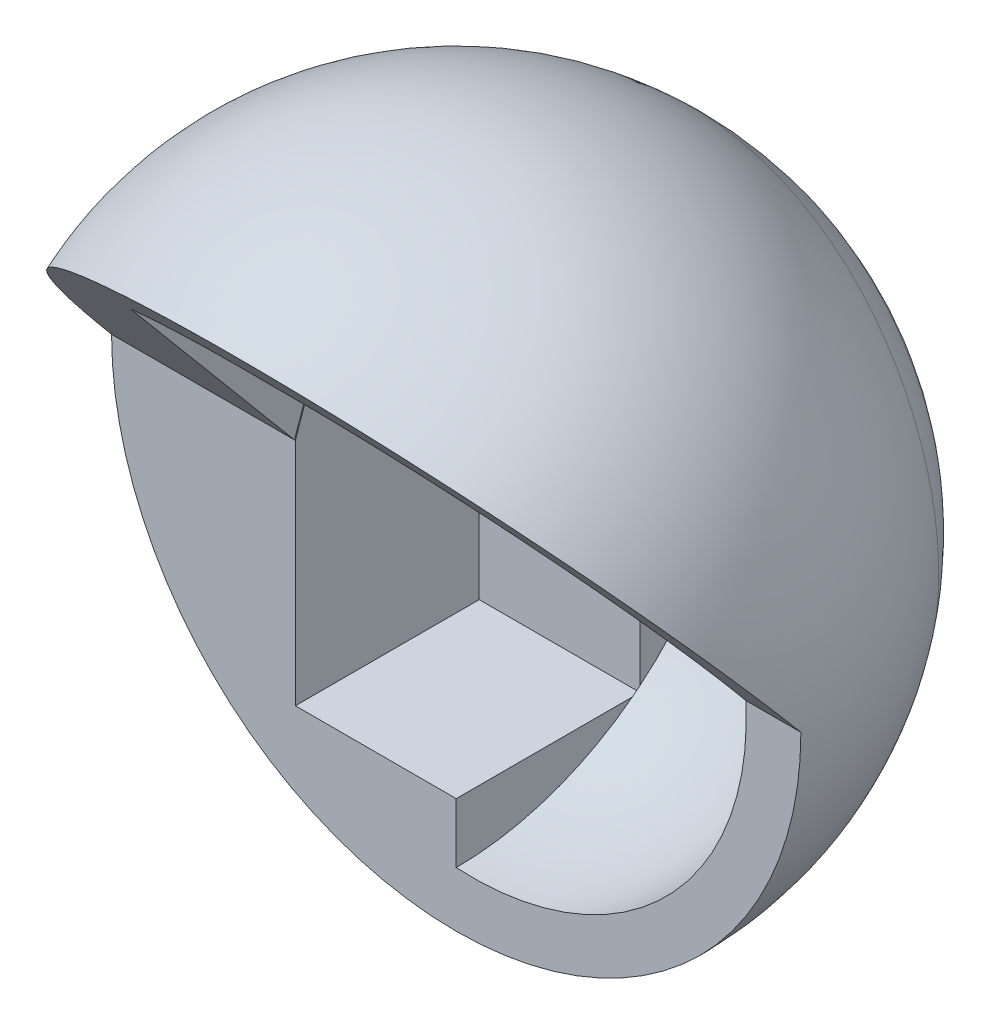
from build123d import *

# Parameters (mm, degrees)
REVOLVE4_ANGLE     = 220
CUT_REVOLVE1_ANGLE = 234
SKETCH11_W         = 8.89
SKETCH11_H         = 25.4
CUT_EXTRUDE3_DEPTH = 10.16
CUT_REVOLVE2_ANGLE = 59


with BuildPart() as part:
    # Sketch3 → Revolve4 (revolve)
    with BuildSketch(Plane.XY):
        with BuildLine():
            ThreePointArc((0, -19.05), (13.470384182, -13.470384182), (19.05, 0))
            Line((19.05, 0), (-19.05, 0))
            ThreePointArc((-19.05, 0), (-13.470384182, -13.470384182), (0, -19.05))
        make_face()
    revolve(axis=Axis((19.05, 0, 0), (1, 0, 0)), revolution_arc=REVOLVE4_ANGLE)

    # Sketch10 → Cut-Revolve1 (revolve, cut)
    with BuildSketch(Plane(origin=(0, 0, 0), x_dir=(1, 0, 0), z_dir=(0, -0.6427876096865458, 0.7660444431189727))):
        with BuildLine():
            Line((0, 0), (0, 16.002))
            ThreePointArc((0, 16.002), (11.594580028, 11.594580028), (16.002, 0))
            Line((16.002, 0), (0, 0))
        make_face()
    revolve(axis=Axis((0, 0, 0), (-1, 0, 0)), revolution_arc=CUT_REVOLVE1_ANGLE, mode=Mode.SUBTRACT)

    # Sketch11 → Cut-Extrude3 (cut)
    with BuildSketch(Plane.XY):
        with Locations((-4.445, 0)):
            Rectangle(SKETCH11_W, SKETCH11_H)
    extrude(amount=-CUT_EXTRUDE3_DEPTH, mode=Mode.SUBTRACT)

    # Sketch12 → Cut-Revolve2 (revolve, cut)
    with BuildSketch(Plane(origin=(0, 0, 0), x_dir=(1, 0, 0), z_dir=(0, -0.6427876096865458, 0.7660444431189727))):
        with BuildLine():
            Line((-8.93894813, 0), (-8.93894813, 14.091056345))
            ThreePointArc((-8.93894813, 14.091056345), (-4.616884939, 15.736081816), (0, 16.002))
            Line((0, 16.002), (0, 0))
            Line((0, 0), (-8.93894813, 0))
        make_face()
    revolve(axis=Axis((0, 0, 0), (-1, 0, 0)), revolution_arc=CUT_REVOLVE2_ANGLE, mode=Mode.SUBTRACT)


solid = part.part
